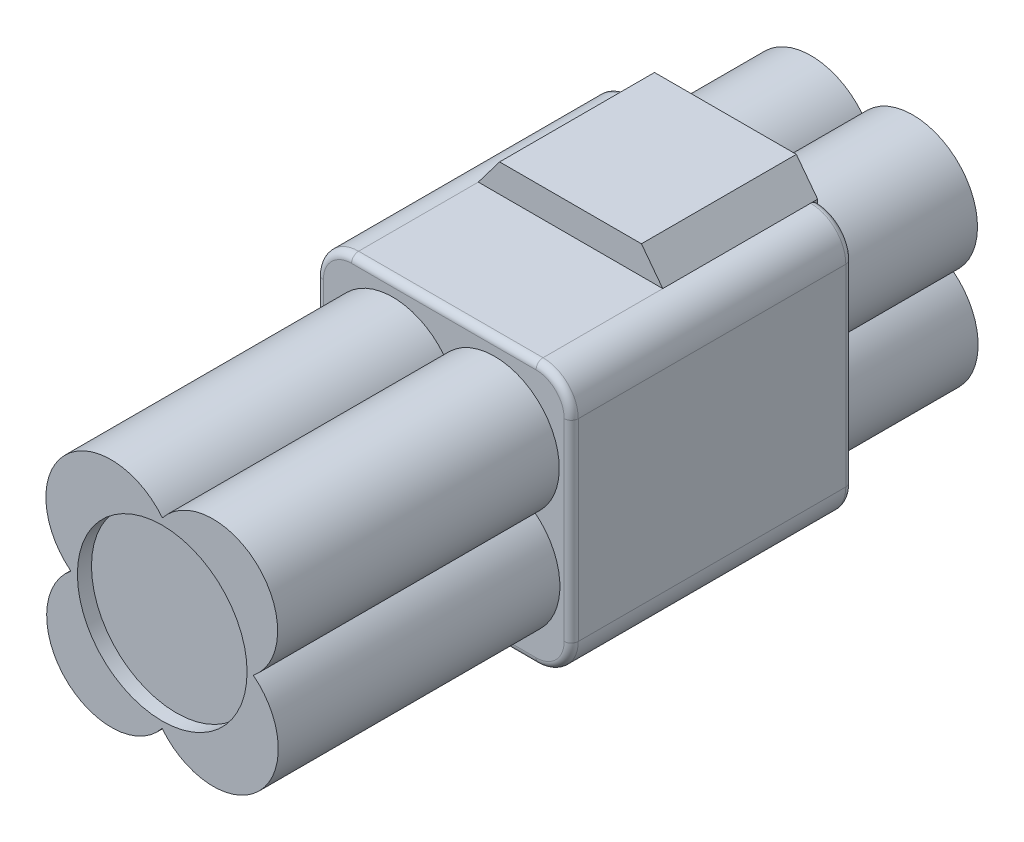
from build123d import *

# Parameters (mm, degrees)
SKETCH_1_W           = 18.1
SKETCH_1_H           = 18.7
EXTRUDE_1_DEPTH      = 20
SKETCH_2_W           = 13.1
SKETCH_2_H           = 11
EXTRUDE_2_DEPTH      = 2
EXTRUDE_3_DEPTH      = 9.7
EXTRUDE_3_DEPTH_BACK = 40
FILLET_1_R           = 2.5
FILLET_2_R           = 0.5
CUT_EXTRUDE_1_DEPTH  = 49.539674531
SKETCH_5_R           = 6.105797263
CUT_EXTRUDE_2_DEPTH  = 1
SKETCH_6_R           = 6.02468661
CUT_EXTRUDE_3_DEPTH  = 1


with BuildPart() as part:
    # ｽｹｯﾁ1 → ﾎﾞｽ - 押し出し1 (new body)
    with BuildSketch(Plane.XY):
        with Locations((9.05, 9.35)):
            Rectangle(SKETCH_1_W, SKETCH_1_H)
    extrude(amount=EXTRUDE_1_DEPTH)

    # ｽｹｯﾁ2 → ﾎﾞｽ - 押し出し2 (add)
    with BuildSketch(Plane(origin=(0, 18.7, 0), x_dir=(1, 0, 0), z_dir=(0, 1, 0))):
        with Locations((9.05, -5.5)):
            Rectangle(SKETCH_2_W, SKETCH_2_H)
    extrude(amount=EXTRUDE_2_DEPTH)

    # ｽｹｯﾁ3 → ﾎﾞｽ - 押し出し3 (add, two sides: drawn at the far end of the back side and taken through both)
    with BuildSketch(Plane(origin=(0, 0, 0), x_dir=(-1, 0, 0), z_dir=(0, 0, -1)).offset(-EXTRUDE_3_DEPTH_BACK)):
        with BuildLine():
            ThreePointArc((-2.566319039, 9.311012343), (-2.144244303, 16.230296479), (-9.064933475, 15.831923002))
            ThreePointArc((-9.064933475, 15.831923002), (-15.903655717, 16.221032622), (-15.521168651, 9.381936787))
            ThreePointArc((-15.521168651, 9.381936787), (-15.948030787, 2.480748206), (-9.045010779, 2.876891972))
            ThreePointArc((-9.045010779, 2.876891972), (-2.204371262, 2.467711109), (-2.566319039, 9.311012343))
        make_face()
    extrude(amount=EXTRUDE_3_DEPTH + EXTRUDE_3_DEPTH_BACK)

    # ﾌｨﾚｯﾄ1
    fillet_1_edges = [part.edges().sort_by_distance(p)[0] for p in [
        (0, 0, 10),
        (18.1, 0, 10),
        (18.1, 18.7, 10),
        (0, 18.7, 10),
    ]]
    fillet(fillet_1_edges, radius=FILLET_1_R)

    # ﾌｨﾚｯﾄ2
    fillet_2_edges = [part.edges().sort_by_distance(p)[0] for p in [
        (0.732233047, 17.967766953, 20),
        (9.05, 18.7, 20),
        (17.367766953, 17.967766953, 20),
        (18.1, 9.35, 20),
        (17.367766953, 0.732233047, 20),
        (9.05, 0, 20),
        (0.732233047, 0.732233047, 20),
        (17.367766953, 17.967766953, 0),
        (18.1, 9.35, 0),
        (17.367766953, 0.732233047, 0),
        (9.05, 0, 0),
        (0.732233047, 0.732233047, 0),
        (0, 9.35, 0),
        (0, 9.35, 20),
        (0.732233047, 17.967766953, 0),
    ]]
    fillet(fillet_2_edges, radius=FILLET_2_R)

    # ｽｹｯﾁ4 → ｶｯﾄ - 押し出し1 (cut, through all)
    with BuildSketch(Plane(origin=(0, 0, 0), x_dir=(-1, 0, 0), z_dir=(0, 0, -1))):
        Polygon((-15.6, 18.7), (-14.085876612, 20.7), (-15.6, 20.7), align=None)
        Polygon((-2.5, 20.7), (-2.5, 18.7), (-4.014123388, 20.7), align=None)
    extrude(amount=-CUT_EXTRUDE_1_DEPTH, mode=Mode.SUBTRACT)

    # ｽｹｯﾁ5 → ｶｯﾄ - 押し出し2 (cut)
    with BuildSketch(Plane(origin=(0, 0, -9.7), x_dir=(-1, 0, 0), z_dir=(0, 0, -1))):
        with Locations((-9.054972127, 9.354407487)):
            Circle(SKETCH_5_R)
    extrude(amount=-CUT_EXTRUDE_2_DEPTH, mode=Mode.SUBTRACT)

    # ｽｹｯﾁ6 → ｶｯﾄ - 押し出し3 (cut)
    with BuildSketch(Plane.XY.offset(40)):
        with Locations((9.054972127, 9.354407487)):
            Circle(SKETCH_6_R)
    extrude(amount=-CUT_EXTRUDE_3_DEPTH, mode=Mode.SUBTRACT)


solid = part.part
